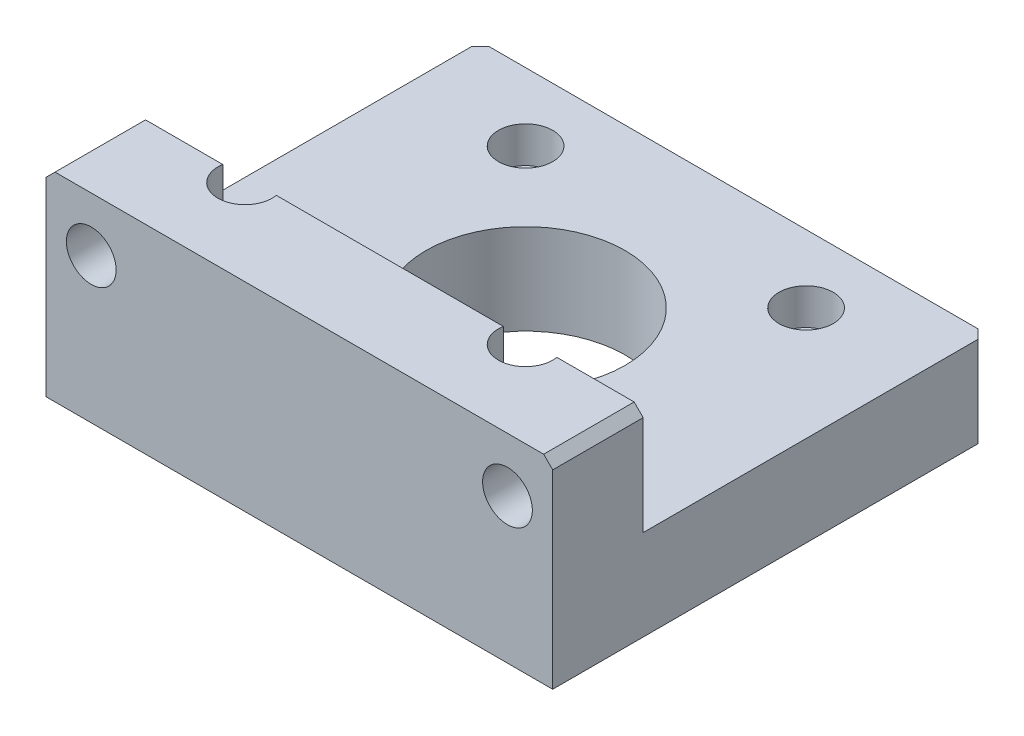
from build123d import *

# Parameters (mm, degrees)
SKETCH_1_W              = 56
SKETCH_1_H              = 48
EXTRUDE_1_DEPTH         = 10
SKETCH_2_R              = 11
CUT_EXTRUDE_1_DEPTH     = 10
HOLE_WIZARD_3_5_3_5_1_D = 3.5
SKETCH_8_W              = 56
SKETCH_8_H              = 10
EXTRUDE_2_DEPTH         = 12
HOLE_WIZARD_5_5_5_5_1_D = 5.5
SKETCH_11_R             = 3
CUT_EXTRUDE_2_DEPTH     = 16
SKETCH_13_R             = 3
CUT_EXTRUDE_3_DEPTH     = 4
CHAMFER_1_SIZE          = 1
CHAMFER_2_SIZE          = 1


with BuildPart() as part:
    # 草图1 → 凸台-拉伸1 (new body)
    with BuildSketch(Plane(origin=(0, 0, 0), x_dir=(1, 0, 0), z_dir=(0, 1, 0))):
        with Locations((28, 24)):
            Rectangle(SKETCH_1_W, SKETCH_1_H)
    extrude(amount=EXTRUDE_1_DEPTH)

    # 草图2 → 切除-拉伸1 (cut)
    with BuildSketch(Plane(origin=(0, 10, 0), x_dir=(1, 0, 0), z_dir=(0, 1, 0))):
        with Locations(Location((28, 25, 0), (0, 0, 270))):
            Circle(SKETCH_2_R)
    extrude(amount=-CUT_EXTRUDE_1_DEPTH, mode=Mode.SUBTRACT)

    # Ø3.5 (3.5) 直径孔1 (through all)
    with Locations(Plane(origin=(0, 10, 0), x_dir=(1, 0, 0), z_dir=(0, 1, 0))):
        with Locations((12.5, 40.5), (43.5, 40.5), (43.5, 9.5), (12.5, 9.5)):
            Hole(HOLE_WIZARD_3_5_3_5_1_D / 2)

    # 草图8 → 凸台-拉伸2 (add)
    with BuildSketch(Plane(origin=(0, 10, 0), x_dir=(1, 0, 0), z_dir=(0, 1, 0))):
        with Locations((28, 5)):
            Rectangle(SKETCH_8_W, SKETCH_8_H)
    extrude(amount=EXTRUDE_2_DEPTH)

    # Ø5.5 (5.5) 直径孔1 (through all)
    with Locations(Plane(origin=(0, 0, -10), x_dir=(-1, 0, 0), z_dir=(0, 0, -1))):
        with Locations((-51, 16), (-5, 16)):
            Hole(HOLE_WIZARD_5_5_5_5_1_D / 2)

    # 草图11 → 切除-拉伸2 (cut)
    with BuildSketch(Plane(origin=(0, 22, 0), x_dir=(1, 0, 0), z_dir=(0, 1, 0))):
        with Locations(Location((12.5, 9.5, 0), (0, 0, 270))):
            Circle(SKETCH_11_R)
        with Locations(Location((43.5, 9.5, 0), (0, 0, 270))):
            Circle(SKETCH_11_R)
    extrude(amount=-CUT_EXTRUDE_2_DEPTH, mode=Mode.SUBTRACT)

    # 草图13 → 切除-拉伸3 (cut)
    with BuildSketch(Plane(origin=(0, 10, 0), x_dir=(1, 0, 0), z_dir=(0, 1, 0))):
        with Locations(Location((12.5, 40.5, 0), (0, 0, 270))):
            Circle(SKETCH_13_R)
        with Locations(Location((43.5, 40.5, 0), (0, 0, 270))):
            Circle(SKETCH_13_R)
    extrude(amount=-CUT_EXTRUDE_3_DEPTH, mode=Mode.SUBTRACT)

    # 倒角1
    chamfer_1_edges = [part.edges().sort_by_distance(p)[0] for p in [
        (56, 5, -48),
        (0, 5, -48),
    ]]
    chamfer(chamfer_1_edges, length=CHAMFER_1_SIZE)

    # 倒角2
    chamfer_2_edges = [part.edges().sort_by_distance(p)[0] for p in [
        (56, 22, -5),
        (0, 22, -5),
    ]]
    chamfer(chamfer_2_edges, length=CHAMFER_2_SIZE)


solid = part.part
